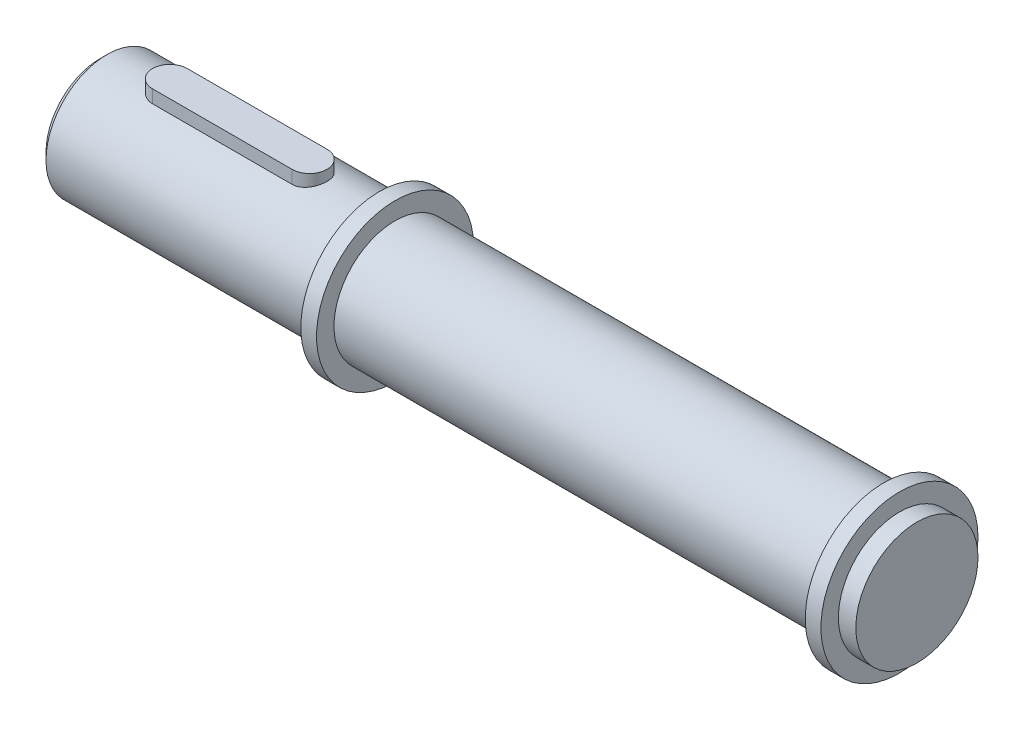
from build123d import *

# Parameters (mm, degrees)
BOSS_EXTRUDE1_START      = 80
SKETCH2_R                = 17.5
BOSS_EXTRUDE1_DEPTH      = 80
BOSS_EXTRUDE2_REACH      = 163.943
BOSS_EXTRUDE2_END_RADIUS = 17.5
SKETCH4_R                = 17.5
BOSS_EXTRUDE3_DEPTH      = 5
HOLE1_D                  = 10.106
HOLE1_DEPTH              = 37.5
HOLE1_CBORE_D            = 13
HOLE1_CBORE_DEPTH        = 9.5
HOLE1_TIP                = 2.91735091
CHAMFER1_SIZE            = 2.55
CHAMFER2_SIZE            = 2


with BuildPart() as part:
    # Sketch1 → Revolve1 (revolve)
    with BuildSketch(Plane.XY, mode=Mode.PRIVATE) as revolve1_sk:
        Polygon((-74.5, 22.5), (-74.5, 0), (74.5, 0), (74.5, 22.5), (70, 22.5), (70, 17.5), (-70, 17.5), (-70, 22.5), align=None)
    revolve(revolve1_sk.sketch.rotate(Axis((-74.5, 0, 0), (1, 0, 0)), 270), axis=Axis((-74.5, 0, 0), (1, 0, 0)))

    # Sketch2 → Boss-Extrude1 (add)
    with BuildSketch(Plane.ZY.offset(74.5).offset(BOSS_EXTRUDE1_START)):
        with Locations(Location((0, 0, 0), (0, 0, 180))):
            Circle(SKETCH2_R)
    extrude(amount=-BOSS_EXTRUDE1_DEPTH)

    # Boss-Extrude2: up to this cylinder (the profile starts outside it)
    boss_extrude2_end = Plane(origin=(-114.5, 0, 0), z_dir=(1, 0, 0)) * Cylinder(BOSS_EXTRUDE2_END_RADIUS, 363.886, mode=Mode.PRIVATE)
    # Sketch3 → Boss-Extrude2 (add, up to the surface)
    with BuildSketch(Plane(origin=(0, 20.5, 0), x_dir=(1, 0, 0), z_dir=(0, 1, 0)), mode=Mode.PRIVATE) as boss_extrude2_sk1:
        with BuildLine():
            Line((-134.5, -5), (-94.5, -5))
            ThreePointArc((-94.5, -5), (-89.5, 0), (-94.5, 5))
            Line((-94.5, 5), (-134.5, 5))
            ThreePointArc((-134.5, 5), (-139.5, 0), (-134.5, -5))
        make_face()
    boss_extrude2_tool1 = extrude(boss_extrude2_sk1.sketch, amount=-BOSS_EXTRUDE2_REACH, mode=Mode.PRIVATE) - boss_extrude2_end
    add(boss_extrude2_tool1.solids().sort_by_distance((-114.5, 20.5, 0))[0])

    # Sketch4 → Boss-Extrude3 (add)
    with BuildSketch(Plane(origin=(74.5, 0, 0), x_dir=(0, 0, -1), z_dir=(1, 0, 0))):
        Circle(SKETCH4_R)
    extrude(amount=BOSS_EXTRUDE3_DEPTH)

    # Hole1
    with Locations(Plane.ZY.offset(154.5)):
        with Locations((0, 0)):
            CounterBoreHole(HOLE1_D / 2, HOLE1_CBORE_D / 2, HOLE1_CBORE_DEPTH, depth=HOLE1_DEPTH)
            with Locations((0, 0, -(HOLE1_DEPTH + HOLE1_TIP / 2))):  # 120° drill point
                Cone(0, HOLE1_D / 2, HOLE1_TIP, mode=Mode.SUBTRACT)

    # Chamfer1
    chamfer1_edges = [part.edges().sort_by_distance(p)[0] for p in [
        (-154.5, 0, -6.5),
    ]]
    chamfer(chamfer1_edges, length=CHAMFER1_SIZE)

    # Chamfer2
    chamfer2_edges = [part.edges().sort_by_distance(p)[0] for p in [
        (-154.5, 0, 17.5),
    ]]
    chamfer(chamfer2_edges, length=CHAMFER2_SIZE)


solid = part.part
